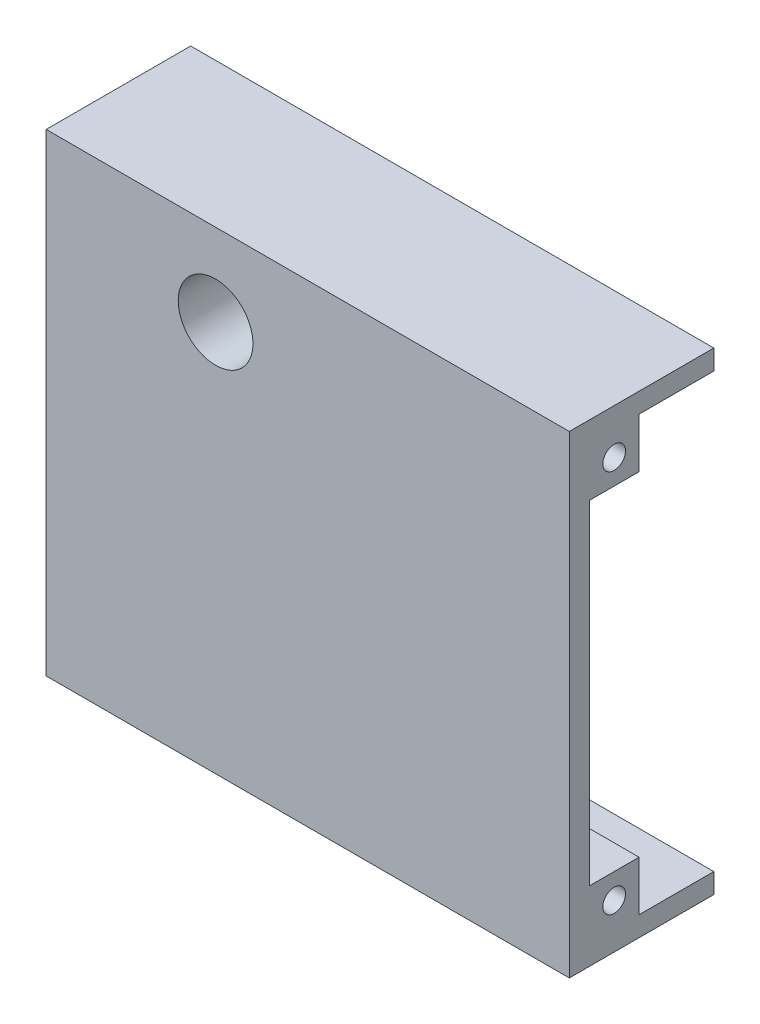
from build123d import *

# Parameters (mm, degrees)
SKETCH_1_W          = 210
SKETCH_1_H          = 190
EXTRUDE_1_DEPTH     = 8
EXTRUDE_2_DEPTH     = 50
SKETCH_3_W          = 20
SKETCH_3_H          = 20
EXTRUDE_3_DEPTH     = 20
SKETCH_8_R          = 4.55
CUT_EXTRUDE_1_DEPTH = 25
SKETCH_9_W          = 120
SKETCH_9_H          = 50
EXTRUDE_4_DEPTH     = 25
SKETCH_10_R         = 15
CUT_EXTRUDE_2_DEPTH = 146.392572025


with BuildPart() as part:
    # 스케치1 → 보스-돌출1 (new body)
    with BuildSketch(Plane.XY):
        Rectangle(SKETCH_1_W, SKETCH_1_H)
    extrude(amount=EXTRUDE_1_DEPTH)

    # 스케치2 → 보스-돌출2 (add)
    with BuildSketch(Plane(origin=(0, 0, 0), x_dir=(-1, 0, 0), z_dir=(0, 0, -1))):
        Polygon((-105, 95), (105, 95), (105, -95), (-105, -95), (-105, -87), (97, -87), (97, 87), (-105, 87), align=None)
    extrude(amount=EXTRUDE_2_DEPTH)

    # 스케치3 → 보스-돌출3 (add)
    with BuildSketch(Plane(origin=(105, 0, 0), x_dir=(0, 0, -1), z_dir=(1, 0, 0))):
        with Locations((10, 77)):
            Rectangle(SKETCH_3_W, SKETCH_3_H)
    extrude_3 = extrude(amount=-EXTRUDE_3_DEPTH)

    # 스케치8 → 컷-돌출1 (cut)
    with BuildSketch(Plane(origin=(105, 0, 0), x_dir=(0, 0, -1), z_dir=(1, 0, 0))):
        with Locations(Location((10, 77, 0), (0, 0, 90))):
            Circle(SKETCH_8_R)
    cut_extrude_1 = extrude(amount=-CUT_EXTRUDE_1_DEPTH, mode=Mode.SUBTRACT)

    # 대칭 복사1: 보스-돌출3, 컷-돌출1 across plane
    add(extrude_3.mirror(Plane(origin=(0, 0, 0), x_dir=(0, 0, 1), z_dir=(0, -1, 0))))
    add(cut_extrude_1.mirror(Plane(origin=(0, 0, 0), x_dir=(0, 0, 1), z_dir=(0, -1, 0))), mode=Mode.SUBTRACT)

    # 스케치9 → 보스-돌출4 (add)
    with BuildSketch(Plane(origin=(0, 0, 0), x_dir=(-1, 0, 0), z_dir=(0, 0, -1))):
        with Locations((37, 62)):
            Rectangle(SKETCH_9_W, SKETCH_9_H)
    extrude(amount=EXTRUDE_4_DEPTH)

    # 스케치10 → 컷-돌출2 (cut, through all)
    with BuildSketch(Plane(origin=(0, 0, -25), x_dir=(-1, 0, 0), z_dir=(0, 0, -1))):
        with Locations((37, 62)):
            Circle(SKETCH_10_R)
    extrude(amount=-CUT_EXTRUDE_2_DEPTH, mode=Mode.SUBTRACT)


solid = part.part
